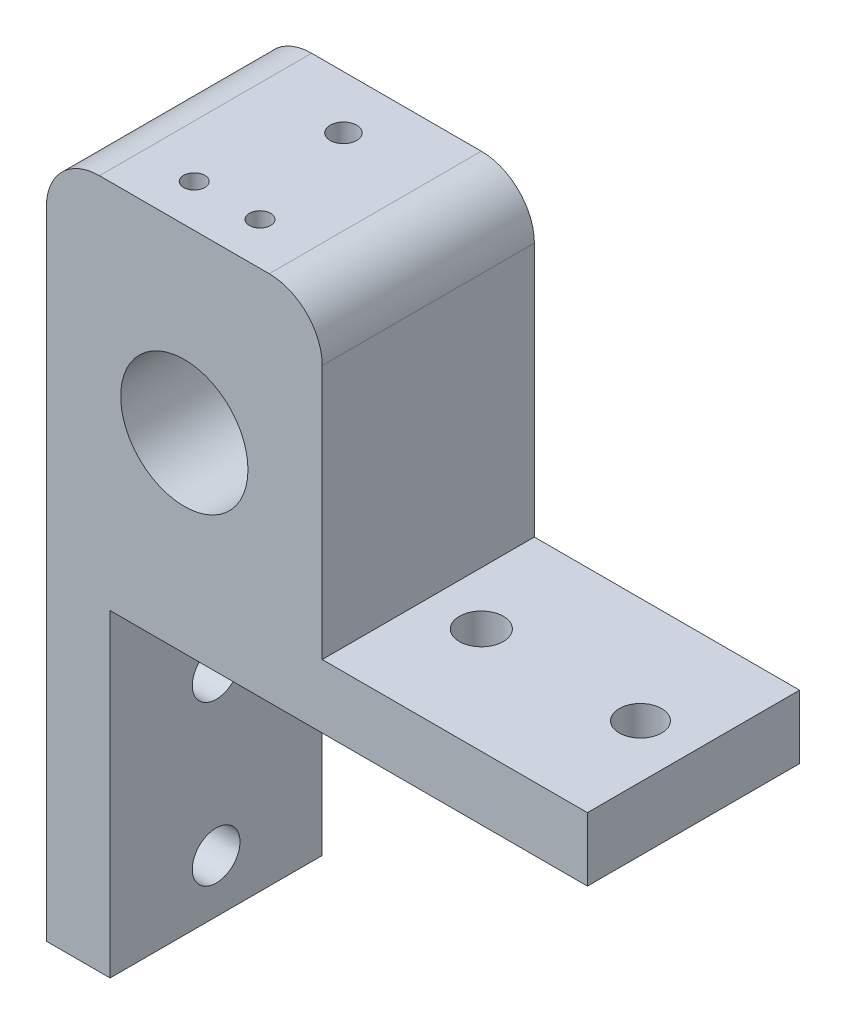
from build123d import *

# Parameters (mm, degrees)
SKETCH1_R               = 6
BOSS_EXTRUDE1_DEPTH     = 20
SKETCH2_R               = 2.25
CUT_EXTRUDE1_DEPTH      = 20
SKETCH3_R               = 2
SKETCH3_R_2             = 2.070364376
CUT_EXTRUDE2_DEPTH      = 20
FILLET1_R               = 5
CUT_EXTRUDE3_REACH      = 79.904
CUT_EXTRUDE3_END_RADIUS = 6
SKETCH5_R               = 1.25
SKETCH6_R               = 1
CUT_EXTRUDE4_DEPTH      = 10


with BuildPart() as part:
    # Sketch1 → Boss-Extrude1 (new body)
    with BuildSketch(Plane.XY):
        Polygon((-13, 22), (13, 22), (13, -7), (38, -7), (38, -13), (13, -13), (-7, -13), (-7, -43), (-13, -43), (-13, -4), align=None)
        with Locations((0, 5)):
            Circle(SKETCH1_R, mode=Mode.SUBTRACT)
    extrude(amount=BOSS_EXTRUDE1_DEPTH)

    # Sketch2 → Cut-Extrude1 (cut)
    with BuildSketch(Plane.ZY.offset(13)):
        with Locations(Location((10, -38, 0), (0, 0, 270))):
            Circle(SKETCH2_R)
        with Locations(Location((10, -23, 0), (0, 0, 270))):
            Circle(SKETCH2_R)
    extrude(amount=-CUT_EXTRUDE1_DEPTH, mode=Mode.SUBTRACT)

    # Sketch3 → Cut-Extrude2 (cut)
    with BuildSketch(Plane(origin=(0, -7, 0), x_dir=(1, 0, 0), z_dir=(0, 1, 0))):
        with Locations(Location((33, -10, 0), (0, 0, 270))):
            Circle(SKETCH3_R)
        with Locations(Location((18, -10, 0), (0, 0, 270))):
            Circle(SKETCH3_R_2)
    extrude(amount=-CUT_EXTRUDE2_DEPTH, mode=Mode.SUBTRACT)

    # Fillet1
    fillet1_edges = [part.edges().sort_by_distance(p)[0] for p in [
        (-13, 22, 10),
        (13, 22, 10),
    ]]
    fillet(fillet1_edges, radius=FILLET1_R)

    # Cut-Extrude3: up to this cylinder (the profile starts outside it)
    cut_extrude3_end = Plane(origin=(0, 5, 5), z_dir=(0, 0, -1)) * Cylinder(CUT_EXTRUDE3_END_RADIUS, 172.808, mode=Mode.PRIVATE)
    # Sketch5 → Cut-Extrude3 (cut, up to the surface)
    with BuildSketch(Plane(origin=(0, 22, 0), x_dir=(1, 0, 0), z_dir=(0, 1, 0)), mode=Mode.PRIVATE) as cut_extrude3_sk1:
        with Locations(Location((0, -5, 0), (0, 0, 270))):
            Circle(SKETCH5_R)
    cut_extrude3_tool1 = extrude(cut_extrude3_sk1.sketch, amount=-CUT_EXTRUDE3_REACH, mode=Mode.PRIVATE) - cut_extrude3_end
    add(cut_extrude3_tool1.solids().sort_by_distance((0, 22, 5))[0], mode=Mode.SUBTRACT)

    # Sketch6 → Cut-Extrude4 (cut)
    with BuildSketch(Plane(origin=(0, 22, 0), x_dir=(1, 0, 0), z_dir=(0, 1, 0))):
        with Locations(Location((3.132178743, -16, 0), (0, 0, 270))):
            Circle(SKETCH6_R)
        with Locations(Location((-3.067821257, -16, 0), (0, 0, 270))):
            Circle(SKETCH6_R)
    extrude(amount=-CUT_EXTRUDE4_DEPTH, mode=Mode.SUBTRACT)


solid = part.part
